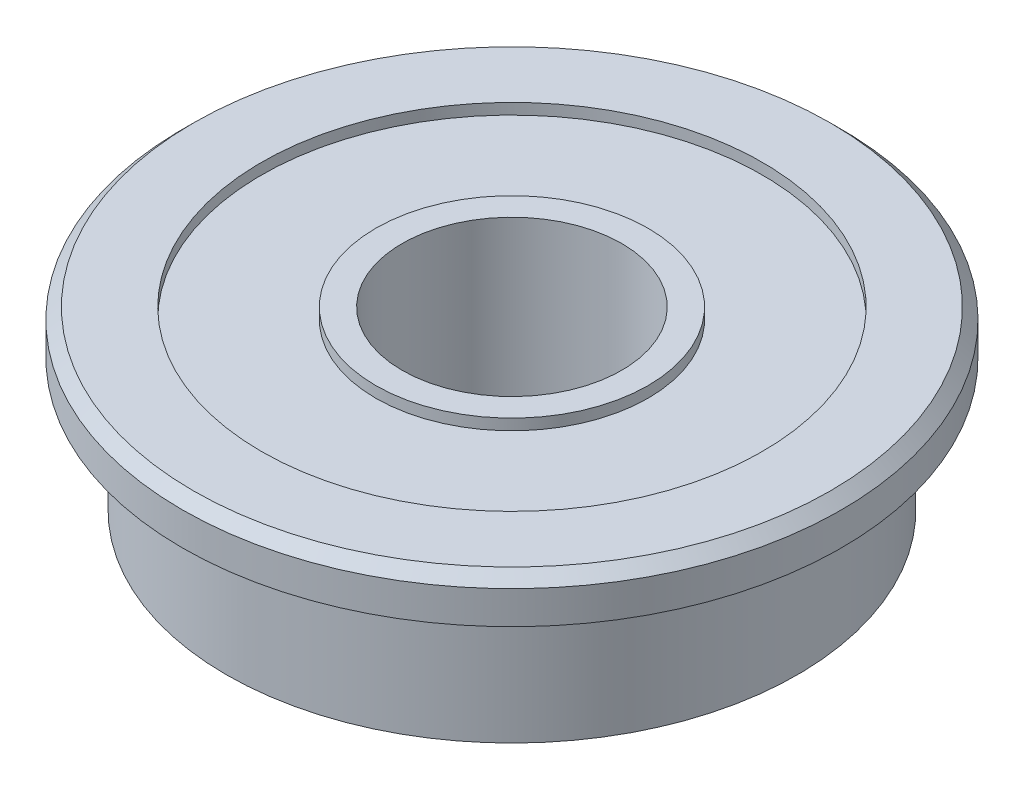
from build123d import *

# Parameters (mm, degrees)
SKETCH1_R           = 6.5
SKETCH1_R_2         = 2.5
BOSS_EXTRUDE1_DEPTH = 3
SKETCH2_R           = 7.5
SKETCH2_R_2         = 2.5
BOSS_EXTRUDE2_DEPTH = 1
SKETCH3_R           = 5.7
SKETCH3_R_2         = 3.1
CUT_EXTRUDE1_DEPTH  = 0.25
CUT_EXTRUDE2_START  = -0.25
SKETCH4_R           = 5.7
SKETCH4_R_2         = 3.1
CUT_EXTRUDE2_DEPTH  = 0.25
CHAMFER1_SIZE       = 0.25


with BuildPart() as part:
    # Sketch1 → Boss-Extrude1 (new body)
    with BuildSketch(Plane(origin=(0, 0, 0), x_dir=(1, 0, 0), z_dir=(0, 1, 0))):
        Circle(SKETCH1_R)
        Circle(SKETCH1_R_2, mode=Mode.SUBTRACT)
    extrude(amount=BOSS_EXTRUDE1_DEPTH)

    # Sketch2 → Boss-Extrude2 (add)
    with BuildSketch(Plane(origin=(0, 3, 0), x_dir=(1, 0, 0), z_dir=(0, 1, 0))):
        Circle(SKETCH2_R)
        Circle(SKETCH2_R_2, mode=Mode.SUBTRACT)
    extrude(amount=BOSS_EXTRUDE2_DEPTH)

    # Sketch3 → Cut-Extrude1 (cut)
    with BuildSketch(Plane.XZ):
        Circle(SKETCH3_R)
        Circle(SKETCH3_R_2, mode=Mode.SUBTRACT)
    extrude(amount=-CUT_EXTRUDE1_DEPTH, mode=Mode.SUBTRACT)

    # Sketch4 → Cut-Extrude2 (cut)
    with BuildSketch(Plane(origin=(0, 4, 0), x_dir=(1, 0, 0), z_dir=(0, 1, 0)).offset(CUT_EXTRUDE2_START)):
        Circle(SKETCH4_R)
        Circle(SKETCH4_R_2, mode=Mode.SUBTRACT)
    extrude(amount=CUT_EXTRUDE2_DEPTH, mode=Mode.SUBTRACT)

    # Chamfer1
    chamfer1_edges = [part.edges().sort_by_distance(p)[0] for p in [
        (-7.5, 4, 0),
    ]]
    chamfer(chamfer1_edges, length=CHAMFER1_SIZE)


solid = part.part
